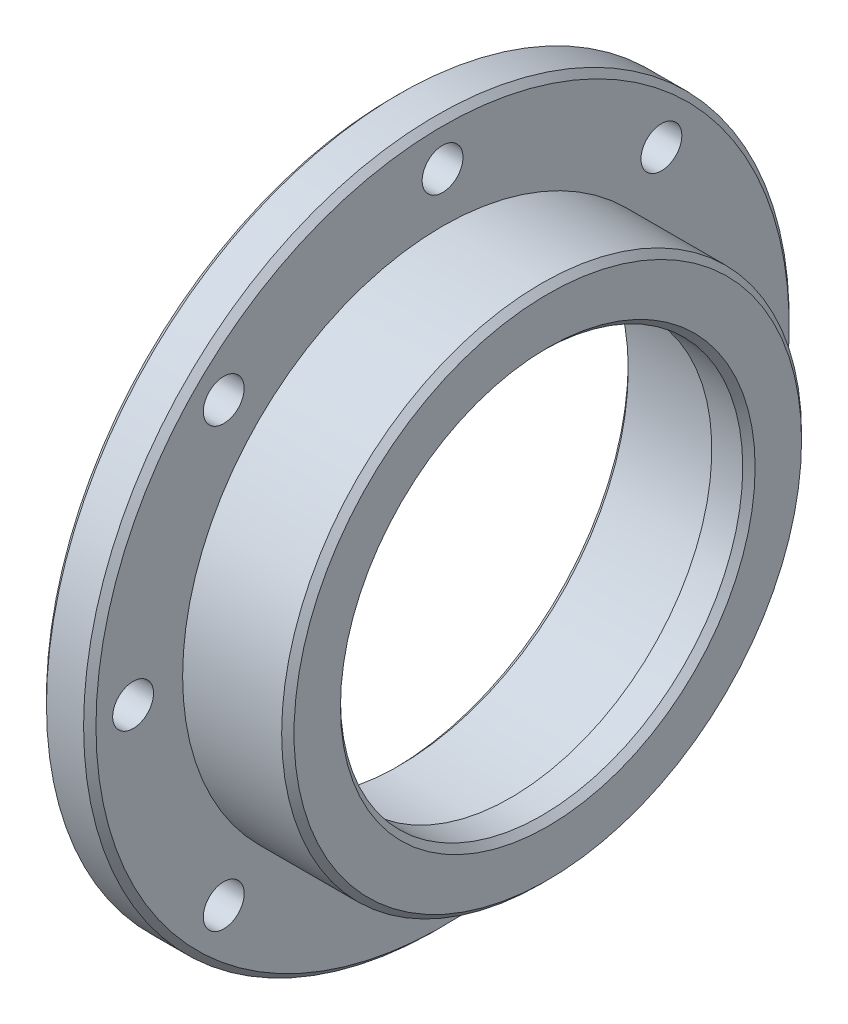
from build123d import *

# Parameters (mm, degrees)
SKETCH_1_W               = 4
SKETCH_1_H               = 7.5
CHAMFER_1_SIZE           = 0.5
HOLE_WIZARD_M4_1_D       = 3.3
PATTERN_CIRCULAR_1_COUNT = 8


with BuildPart() as part:
    # 草图1 → 旋转1 (revolve)
    with BuildSketch(Plane.XY, mode=Mode.PRIVATE) as revolve_1_sk:
        with Locations((2, 24.75)):
            Rectangle(SKETCH_1_W, SKETCH_1_H)
        Polygon((4, 21), (0, 21), (0, 18.5), (9.5, 18.5), (9.5, 21), align=None)
        Polygon((12.5, 21), (9.5, 21), (9.5, 18.5), (9.5, 16.25), (12.5, 16.25), align=None)
    revolve(revolve_1_sk.sketch.rotate(Axis((0, 0, 0), (1, 0, 0)), 90), axis=Axis((0, 0, 0), (1, 0, 0)))

    # 倒角1
    chamfer_1_edges = [part.edges().sort_by_distance(p)[0] for p in [
        (0, 0, -18.5),
        (0, 0, -28.5),
        (4, 0, -28.5),
        (12.5, 0, -16.25),
        (12.5, 0, -21),
    ]]
    chamfer(chamfer_1_edges, length=CHAMFER_1_SIZE)

    # M4 螺纹孔1 (through all)
    with Locations(Plane(origin=(4, 0, 0), x_dir=(0, 0, -1), z_dir=(1, 0, 0))):
        with Locations((0, 25)):
            hole_wizard_m4_1 = Hole(HOLE_WIZARD_M4_1_D / 2)

    # 阵列(圆周)1: M4 螺纹孔1 ×8 about axis
    pattern_circular_1_axis = Axis((0, 0, 0), (1, 0, 0))
    for i in range(1, PATTERN_CIRCULAR_1_COUNT):
        add(hole_wizard_m4_1.rotate(pattern_circular_1_axis, i * 360 / PATTERN_CIRCULAR_1_COUNT), mode=Mode.SUBTRACT)


solid = part.part
